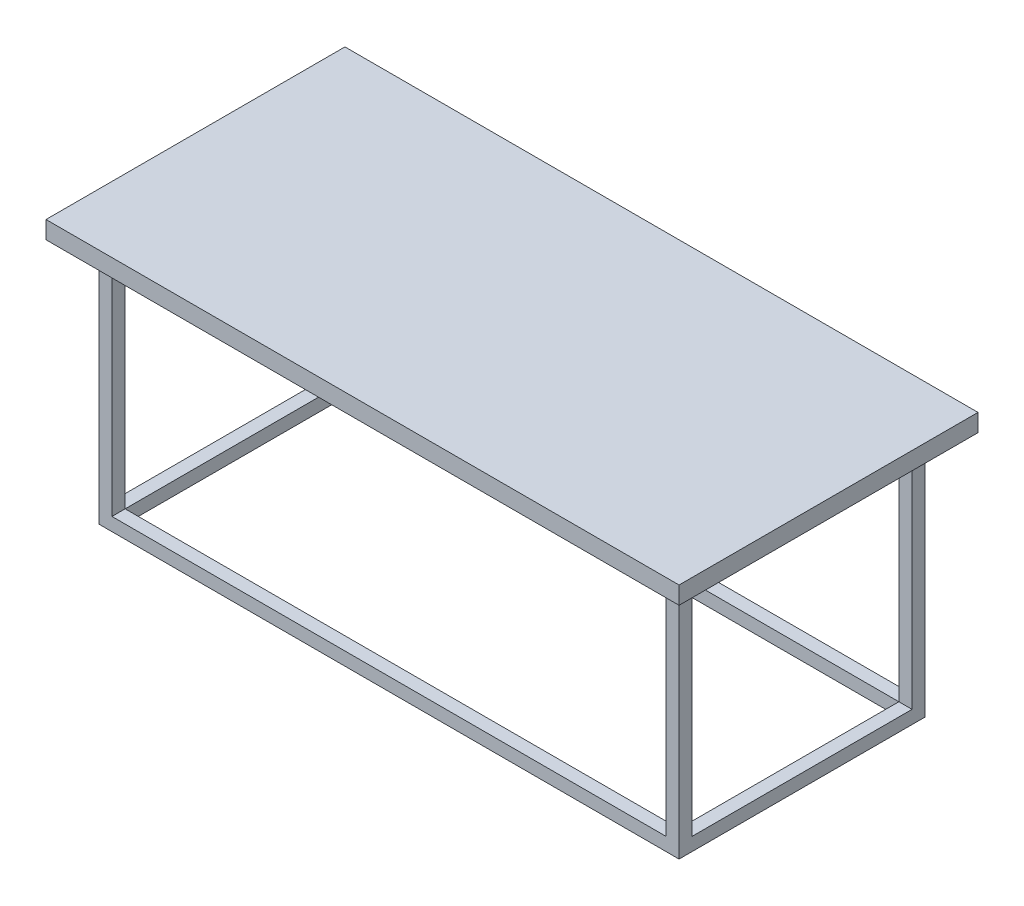
from build123d import *

# Parameters (mm, degrees)
SKETCH1_W           = 1828.8
SKETCH1_H           = 863.6
BOSS_EXTRUDE1_DEPTH = 50.8
SKETCH2_W           = 1676.4
SKETCH2_H           = 711.2
SKETCH2_W_2         = 1600.2
SKETCH2_H_2         = 635
BOSS_EXTRUDE2_DEPTH = 50.8
SKETCH3_W           = 38.1
SKETCH3_H           = 38.1
BOSS_EXTRUDE3_DEPTH = 660.4
BOSS_EXTRUDE4_REACH = 1907.72
SKETCH4_W           = 38.1
SKETCH4_H           = 38.1
BOSS_EXTRUDE5_REACH = 1381.632
SKETCH5_W           = 38.1
SKETCH5_H           = 38.1


with BuildPart() as part:
    # Sketch1 → Boss-Extrude1 (new body)
    with BuildSketch(Plane(origin=(0, 0, 0), x_dir=(1, 0, 0), z_dir=(0, 1, 0))):
        Rectangle(SKETCH1_W, SKETCH1_H)
    extrude(amount=BOSS_EXTRUDE1_DEPTH)

    # Sketch2 → Boss-Extrude2 (add)
    with BuildSketch(Plane.XZ):
        Rectangle(SKETCH2_W, SKETCH2_H)
        Rectangle(SKETCH2_W_2, SKETCH2_H_2, mode=Mode.SUBTRACT)
    extrude(amount=BOSS_EXTRUDE2_DEPTH)

    # Sketch3 → Boss-Extrude3 (add)
    with BuildSketch(Plane.XZ.offset(50.8)):
        with Locations((-819.15, 336.55)):
            Rectangle(SKETCH3_W, SKETCH3_H)
        with Locations((819.15, 336.55)):
            Rectangle(SKETCH3_W, SKETCH3_H)
        with Locations((819.15, -336.55)):
            Rectangle(SKETCH3_W, SKETCH3_H)
        with Locations((-819.15, -336.55)):
            Rectangle(SKETCH3_W, SKETCH3_H)
    extrude(amount=BOSS_EXTRUDE3_DEPTH)

    # Sketch4 → Boss-Extrude4 (add, up to next)
    with BuildSketch(Plane(origin=(-800.1, 0, 0), x_dir=(0, 0, -1), z_dir=(1, 0, 0)), mode=Mode.PRIVATE) as boss_extrude4_sk1:
        with Locations((-336.55, -692.15)):
            Rectangle(SKETCH4_W, SKETCH4_H)
    boss_extrude4_tool1 = extrude(boss_extrude4_sk1.sketch, amount=BOSS_EXTRUDE4_REACH, mode=Mode.PRIVATE) - part.part
    # Sketch4 → Boss-Extrude4 (add, up to next)
    with BuildSketch(Plane(origin=(-800.1, 0, 0), x_dir=(0, 0, -1), z_dir=(1, 0, 0)), mode=Mode.PRIVATE) as boss_extrude4_sk2:
        with Locations((336.55, -692.15)):
            Rectangle(SKETCH4_W, SKETCH4_H)
    boss_extrude4_tool2 = extrude(boss_extrude4_sk2.sketch, amount=BOSS_EXTRUDE4_REACH, mode=Mode.PRIVATE) - part.part
    add(boss_extrude4_tool1.solids().sort_by_distance((-800.1, -692.15, 336.55))[0])
    add(boss_extrude4_tool2.solids().sort_by_distance((-800.1, -692.15, -336.55))[0])

    # Sketch5 → Boss-Extrude5 (add, up to next)
    with BuildSketch(Plane.XY.offset(-317.5), mode=Mode.PRIVATE) as boss_extrude5_sk1:
        with Locations((-819.15, -692.15)):
            Rectangle(SKETCH5_W, SKETCH5_H)
    boss_extrude5_tool1 = extrude(boss_extrude5_sk1.sketch, amount=BOSS_EXTRUDE5_REACH, mode=Mode.PRIVATE) - part.part
    # Sketch5 → Boss-Extrude5 (add, up to next)
    with BuildSketch(Plane.XY.offset(-317.5), mode=Mode.PRIVATE) as boss_extrude5_sk2:
        with Locations((819.15, -692.15)):
            Rectangle(SKETCH5_W, SKETCH5_H)
    boss_extrude5_tool2 = extrude(boss_extrude5_sk2.sketch, amount=BOSS_EXTRUDE5_REACH, mode=Mode.PRIVATE) - part.part
    add(boss_extrude5_tool1.solids().sort_by_distance((-819.15, -692.15, -317.5))[0])
    add(boss_extrude5_tool2.solids().sort_by_distance((819.15, -692.15, -317.5))[0])


solid = part.part
